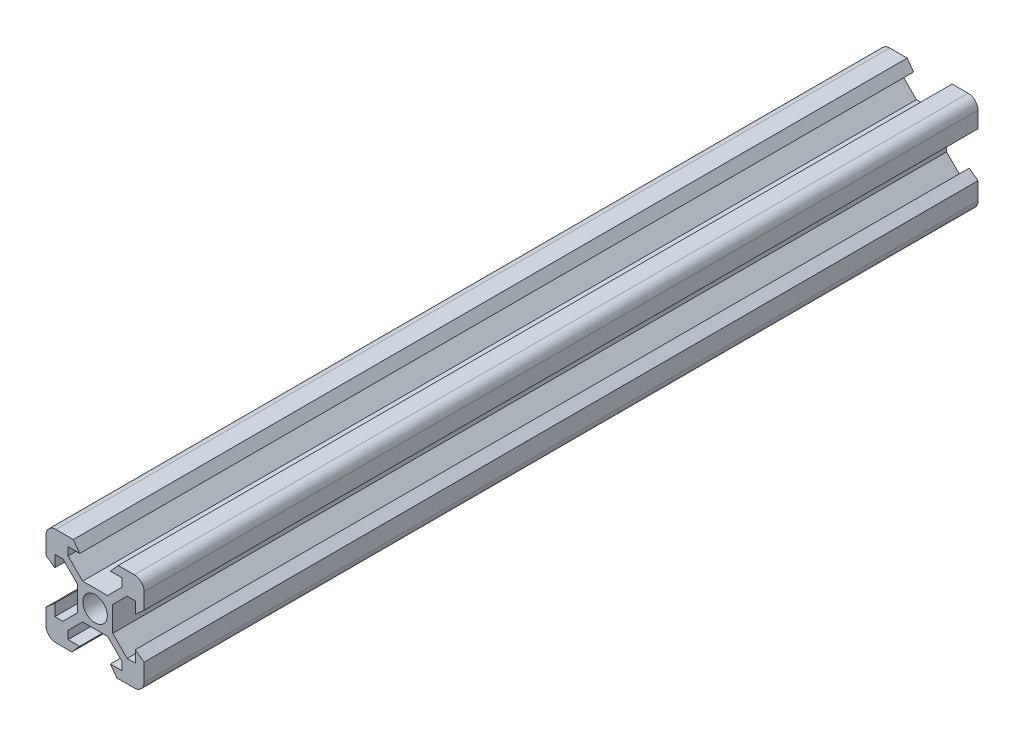
from build123d import *

# Parameters (mm, degrees)
SKETCH1_R               = 2.5
ALUMINIUM_PROFILE_DEPTH = 170


with BuildPart() as part:
    # Sketch1 → Aluminium_profile (new body)
    with BuildSketch(Plane.XY):
        with BuildLine():
            Line((-4.725542729, -10), (-3.125, -8.2))
            Line((-3.125, -8.2), (-5.5, -8.2))
            Line((-5.5, -8.2), (-5.5, -6.560660172))
            Line((-5.5, -6.560660172), (-2.539339828, -3.6))
            Line((-2.539339828, -3.6), (2.539339828, -3.6))
            Line((2.539339828, -3.6), (5.5, -6.560660172))
            Line((5.5, -6.560660172), (5.5, -8.2))
            Line((5.5, -8.2), (3.125, -8.2))
            Line((3.125, -8.2), (4.434457271, -10))
            Line((4.434457271, -10), (8, -10))
            ThreePointArc((8, -10), (9.414213562, -9.414213562), (10, -8))
            Line((10, -8), (10, -4.434457271))
            Line((10, -4.434457271), (8.2, -3.125))
            Line((8.2, -3.125), (8.2, -5.5))
            Line((8.2, -5.5), (6.560660172, -5.5))
            Line((6.560660172, -5.5), (3.6, -2.539339828))
            Line((3.6, -2.539339828), (3.6, 2.539339828))
            Line((3.6, 2.539339828), (6.560660172, 5.5))
            Line((6.560660172, 5.5), (8.2, 5.5))
            Line((8.2, 5.5), (8.2, 3.125))
            Line((8.2, 3.125), (10, 4.725542729))
            Line((10, 4.725542729), (10, 8))
            ThreePointArc((10, 8), (9.414213562, 9.414213562), (8, 10))
            Line((8, 10), (4.725542729, 10))
            Line((4.725542729, 10), (3.125, 8.2))
            Line((3.125, 8.2), (5.5, 8.2))
            Line((5.5, 8.2), (5.5, 6.560660172))
            Line((5.5, 6.560660172), (2.539339828, 3.6))
            Line((2.539339828, 3.6), (-2.539339828, 3.6))
            Line((-2.539339828, 3.6), (-5.5, 6.560660172))
            Line((-5.5, 6.560660172), (-5.5, 8.2))
            Line((-5.5, 8.2), (-3.125, 8.2))
            Line((-3.125, 8.2), (-4.434457271, 10))
            Line((-4.434457271, 10), (-8, 10))
            ThreePointArc((-8, 10), (-9.414213562, 9.414213562), (-10, 8))
            Line((-10, 8), (-10, 4.434457271))
            Line((-10, 4.434457271), (-8.2, 3.125))
            Line((-8.2, 3.125), (-8.2, 5.5))
            Line((-8.2, 5.5), (-6.560660172, 5.5))
            Line((-6.560660172, 5.5), (-3.6, 2.539339828))
            Line((-3.6, 2.539339828), (-3.6, -2.539339828))
            Line((-3.6, -2.539339828), (-6.560660172, -5.5))
            Line((-6.560660172, -5.5), (-8.2, -5.5))
            Line((-8.2, -5.5), (-8.2, -3.125))
            Line((-8.2, -3.125), (-10, -4.725542729))
            Line((-10, -4.725542729), (-10, -8))
            ThreePointArc((-10, -8), (-9.414213562, -9.414213562), (-8, -10))
            Line((-8, -10), (-4.725542729, -10))
        make_face()
        Circle(SKETCH1_R, mode=Mode.SUBTRACT)
    extrude(amount=ALUMINIUM_PROFILE_DEPTH)


solid = part.part
